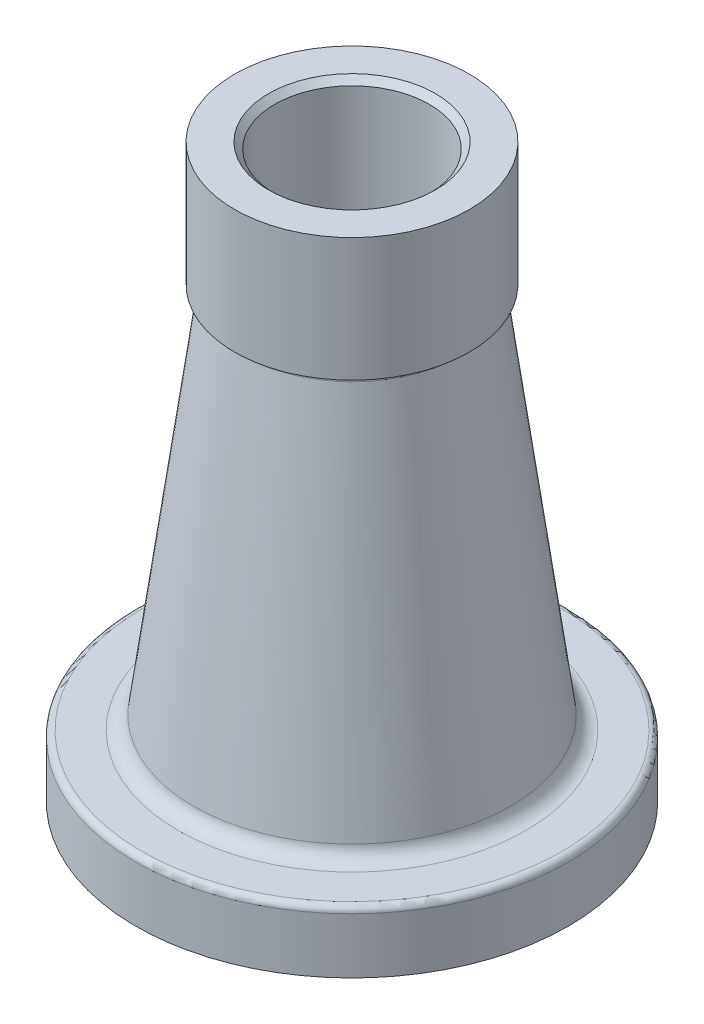
from build123d import *

# Parameters (mm, degrees)
FILLET1_R     = 5
CHAMFER1_SIZE = 2
FILLET2_R     = 1
FILLET3_R     = 2
FILLET4_R     = 2


with BuildPart() as part:
    # Sketch1 → Revolve1 (revolve)
    with BuildSketch(Plane.XY):
        Polygon((50, -88.657309004), (50, -92.5), (70, -92.5), (70, -72.5), (51.919566163, -72.5), (35.129649231, 52.5), (38, 52.5), (38, 92.5), (25.03984406, 92.5), (25.03984406, 90.5), (25.03984406, 52.5), (44, -88.657309004), align=None)
    revolve(axis=Axis((0, -92.5, 0), (0, 1, 0)))

    # Fillet1
    fillet1_edges = [part.edges().sort_by_distance(p)[0] for p in [
        (-51.919566163, -72.5, 0),
    ]]
    fillet(fillet1_edges, radius=FILLET1_R)

    # Chamfer1
    chamfer1_edges = [part.edges().sort_by_distance(p)[0] for p in [
        (-25.03984406, 92.5, 0),
    ]]
    chamfer(chamfer1_edges, length=CHAMFER1_SIZE)

    # Fillet2
    fillet2_edges = [part.edges().sort_by_distance(p)[0] for p in [
        (-50, -88.657309004, 0),
    ]]
    fillet(fillet2_edges, radius=FILLET2_R)

    # Fillet3
    fillet3_edges = [part.edges().sort_by_distance(p)[0] for p in [
        (-70, -72.5, 0),
    ]]
    fillet(fillet3_edges, radius=FILLET3_R)

    # Fillet4
    fillet4_edges = [part.edges().sort_by_distance(p)[0] for p in [
        (-35.129649231, 52.5, 0),
    ]]
    fillet(fillet4_edges, radius=FILLET4_R)


solid = part.part
